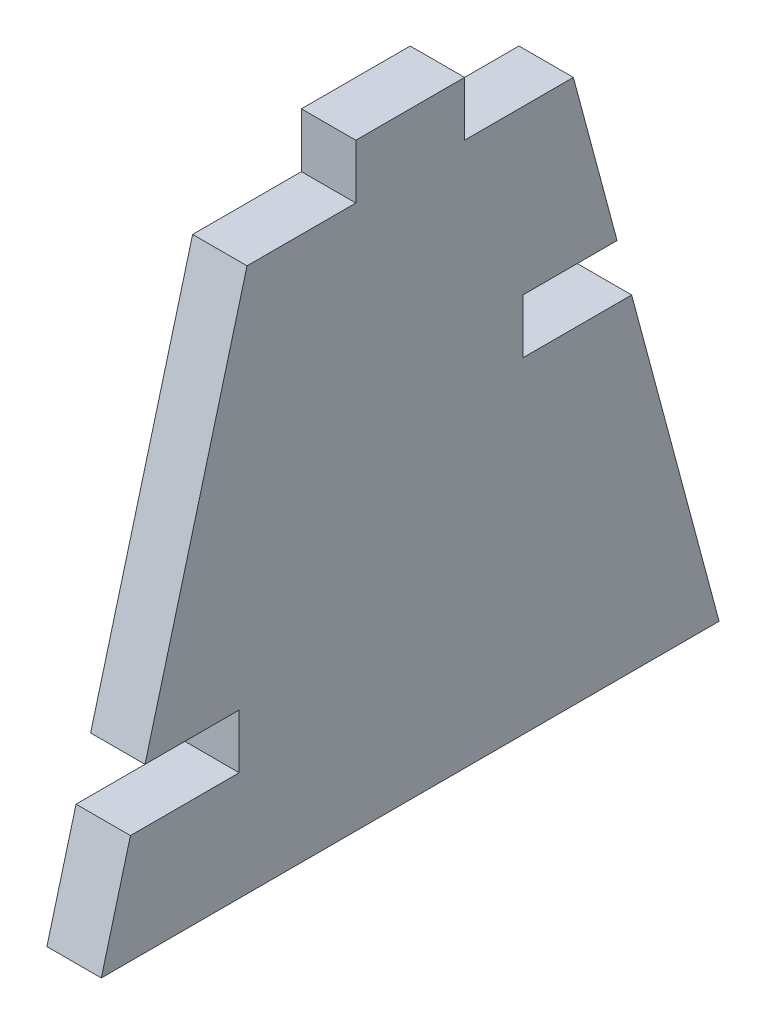
from build123d import *

# Parameters (mm, degrees)
BOSS_EXTRUDE1_DEPTH = 10


with BuildPart() as part:
    # Sketch1 → Boss-Extrude1 (new body)
    with BuildSketch(Plane(origin=(0, 0, 0), x_dir=(0, 0, -1), z_dir=(1, 0, 0))):
        Polygon((0, 0), (113.589838486, 0), (97.51288694, 60), (77.51288694, 60), (77.51288694, 70), (94.833395016, 70), (86.794919243, 100), (66.794919243, 100), (66.794919243, 110), (46.794919243, 110), (46.794919243, 100), (26.794919243, 100), (8.038475773, 30), (25.358983849, 30), (25.358983849, 20), (5.358983849, 20), align=None)
    extrude(amount=-BOSS_EXTRUDE1_DEPTH)


solid = part.part
